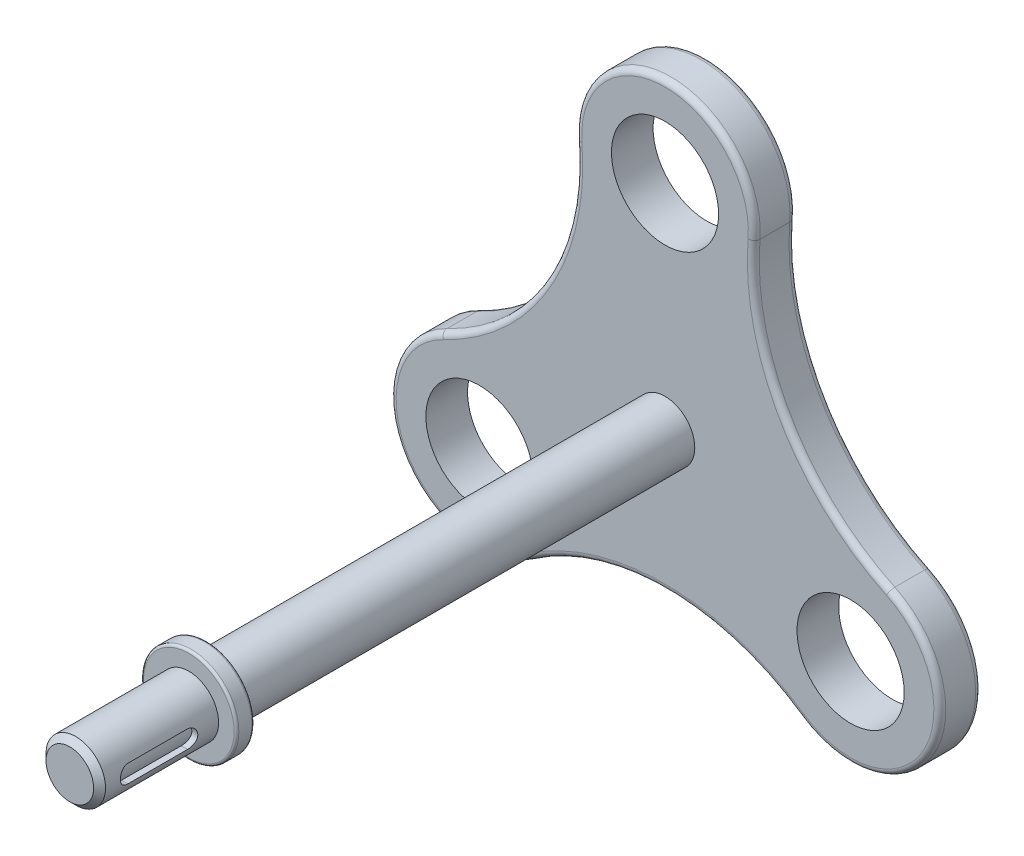
from build123d import *

# Parameters (mm, degrees)
SKETCH1_R               = 4.5
BOSS_EXTRUDE1_DEPTH     = 3.5
SKETCH2_R               = 2.5
BOSS_EXTRUDE2_DEPTH     = 50
CHAMFER1_SIZE           = 0.5
SKETCH4_R               = 4
BOSS_EXTRUDE3_DEPTH     = 1.5
FILLET1_R               = 0.2
CUT_EXTRUDE3_REACH      = 70.605
CUT_EXTRUDE3_END_RADIUS = 2
CUT_EXTRUDE3_START      = 5
FILLET2_R               = 0.2
FILLET3_R               = 0.5


with BuildPart() as part:
    # Sketch1 → Boss-Extrude1 (new body)
    with BuildSketch(Plane.XY):
        with BuildLine():
            ThreePointArc((7.476559852, 17.407502934), (0, 25.5), (-7.476559852, 17.407502934))
            ThreePointArc((-7.476559852, 17.407502934), (-10.093544717, 5.827510759), (-18.813619684, -2.228860702))
            ThreePointArc((-18.813619684, -2.228860702), (-22.083647797, -12.75), (-11.337059831, -15.178642232))
            ThreePointArc((-11.337059831, -15.178642232), (0, -11.655021518), (11.337059831, -15.178642232))
            ThreePointArc((11.337059831, -15.178642232), (22.083647797, -12.75), (18.813619684, -2.228860702))
            ThreePointArc((18.813619684, -2.228860702), (10.093544717, 5.827510759), (7.476559852, 17.407502934))
        make_face()
        with Locations((0, 18)):
            Circle(SKETCH1_R, mode=Mode.SUBTRACT)
        with Locations((-15.588457268, -9)):
            Circle(SKETCH1_R, mode=Mode.SUBTRACT)
        with Locations((15.588457268, -9)):
            Circle(SKETCH1_R, mode=Mode.SUBTRACT)
    extrude(amount=BOSS_EXTRUDE1_DEPTH)

    # Sketch2 → Boss-Extrude2 (add)
    with BuildSketch(Plane.XY.offset(3.5)):
        Circle(SKETCH2_R)
    extrude(amount=BOSS_EXTRUDE2_DEPTH)

    # Chamfer1
    chamfer1_edges = [part.edges().sort_by_distance(p)[0] for p in [
        (-2.5, 0, 53.5),
    ]]
    chamfer(chamfer1_edges, length=CHAMFER1_SIZE)

    # Sketch4 → Boss-Extrude3 (add)
    with BuildSketch(Plane.XY.offset(43.5)):
        Circle(SKETCH4_R)
    extrude(amount=-BOSS_EXTRUDE3_DEPTH)

    # Fillet1
    fillet1_edges = [part.edges().sort_by_distance(p)[0] for p in [
        (-4, 0, 42),
    ]]
    fillet(fillet1_edges, radius=FILLET1_R)

    # Cut-Extrude3: up to this cylinder (the profile starts outside it)
    cut_extrude3_end = Plane(origin=(0, 0, 48.5), z_dir=(0, 0, -1)) * Cylinder(CUT_EXTRUDE3_END_RADIUS, 146.21, mode=Mode.PRIVATE)
    # Sketch5 → Cut-Extrude3 (cut, up to the surface)
    with BuildSketch(Plane(origin=(0, 0, 0), x_dir=(0, 0, -1), z_dir=(1, 0, 0)).offset(CUT_EXTRUDE3_START), mode=Mode.PRIVATE) as cut_extrude3_sk1:
        with BuildLine():
            Line((-51, 0.75), (-46, 0.75))
            ThreePointArc((-46, 0.75), (-45.25, 0), (-46, -0.75))
            Line((-46, -0.75), (-51, -0.75))
            ThreePointArc((-51, -0.75), (-51.75, 0), (-51, 0.75))
        make_face()
    cut_extrude3_tool1 = extrude(cut_extrude3_sk1.sketch, amount=-CUT_EXTRUDE3_REACH, mode=Mode.PRIVATE) - cut_extrude3_end
    add(cut_extrude3_tool1.solids().sort_by_distance((5, 0, 48.5))[0], mode=Mode.SUBTRACT)

    # Fillet2
    fillet2_edges = [part.edges().sort_by_distance(p)[0] for p in [
        (-4, 0, 43.5),
    ]]
    fillet(fillet2_edges, radius=FILLET2_R)

    # Fillet3
    fillet3_edges = [part.edges().sort_by_distance(p)[0] for p in [
        (0, -11.655021518, 3.5),
        (22.083647797, -12.75, 3.5),
        (10.093544717, 5.827510759, 3.5),
        (0, 25.5, 3.5),
        (-10.093544717, 5.827510759, 3.5),
        (0, 25.5, 0),
        (10.093544717, 5.827510759, 0),
        (22.083647797, -12.75, 0),
        (0, -11.655021518, 0),
        (-22.083647797, -12.75, 0),
        (-10.093544717, 5.827510759, 0),
        (-22.083647797, -12.75, 3.5),
    ]]
    fillet(fillet3_edges, radius=FILLET3_R)


solid = part.part
